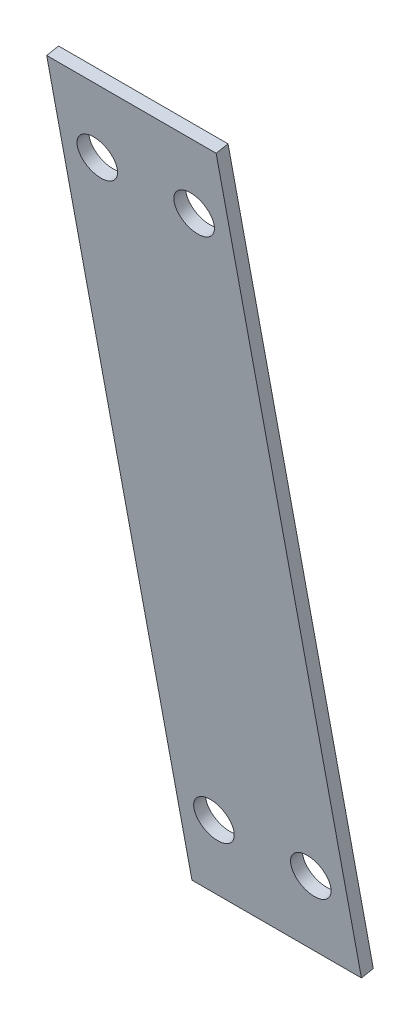
from build123d import *

# Parameters (mm, degrees)
LEAF_START           = 96
LEAF_DEPTH           = 28
SKETCH_2_R           = 3.3
MOUNTING_HOLES_DEPTH = 4


with BuildPart() as part:
    # 草图1 → Leaf (new body)
    with BuildSketch(Plane(origin=(0, 0, 0), x_dir=(0, 0, -1), z_dir=(1, 0, 0)).offset(LEAF_START)):
        Polygon((0.98338218, 40.181547479), (-23.01661782, 170.181547479), (-24.98338218, 169.818452521), (-0.98338218, 39.818452521), align=None)
    extrude(amount=LEAF_DEPTH)

    # 草图2 → Mounting Holes (cut, symmetric)
    with BuildSketch(Plane(origin=(0, 1.136832012, -6.157840067), x_dir=(1, 0, 0), z_dir=(0, -0.18154747945610336, 0.9833821803872266))):
        with Locations(Location((102, 52.335287215, 0), (0, 0, 270))):
            Circle(SKETCH_2_R)
        with Locations(Location((118, 52.335287215, 0), (0, 0, 270))):
            Circle(SKETCH_2_R)
        with Locations(Location((102, 158.532110173, 0), (0, 0, 270))):
            Circle(SKETCH_2_R)
        with Locations(Location((118, 158.532110173, 0), (0, 0, 270))):
            Circle(SKETCH_2_R)
    extrude(amount=MOUNTING_HOLES_DEPTH, both=True, mode=Mode.SUBTRACT)


solid = part.part
